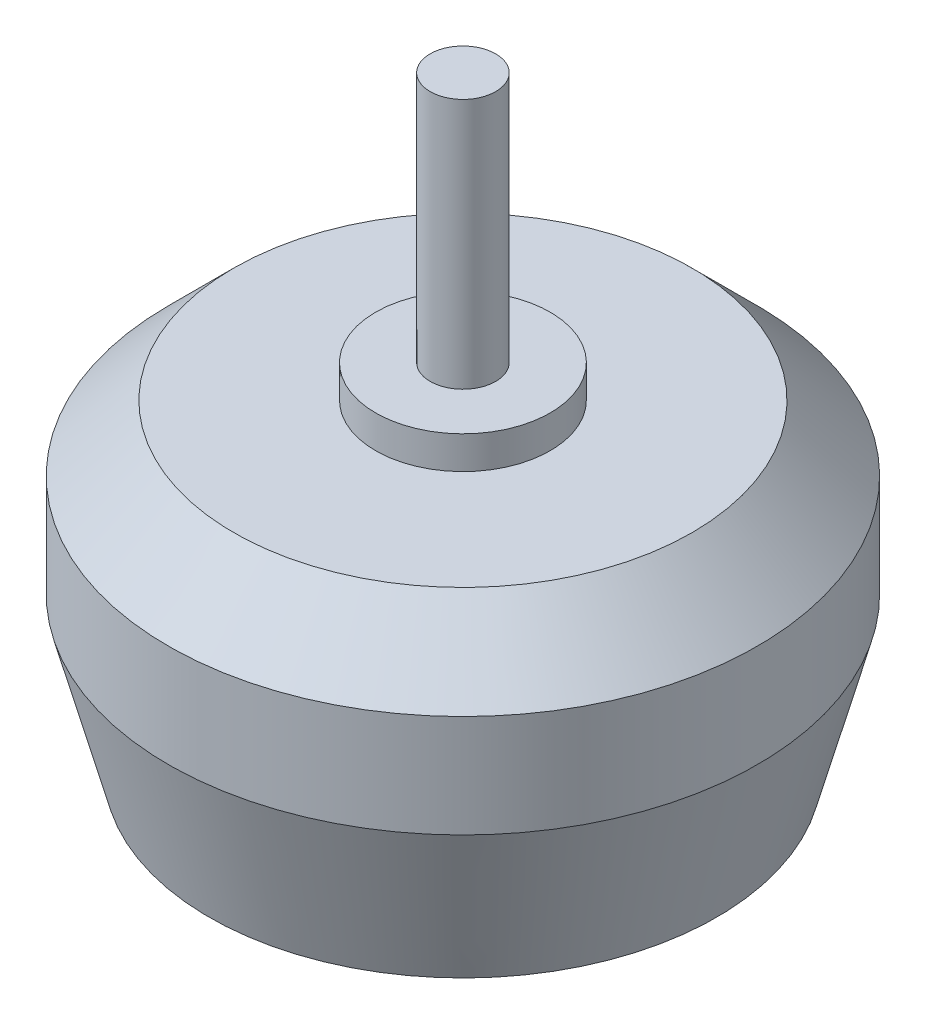
from build123d import *

# Parameters (mm, degrees)
SKETCH3_R          = 1.375
CUT_EXTRUDE1_DEPTH = 2


with BuildPart() as part:
    # Sketch2 → Revolve1 (revolve)
    with BuildSketch(Plane.XY, mode=Mode.PRIVATE) as revolve1_sk:
        Polygon((1.5, 0), (11.624355653, 0), (13.5, 7), (13.5, 11.7), (10.5, 14.7), (4, 14.7), (4, 16.2), (1.5, 16.2), (1.5, 27.7), (0, 27.7), (0, -2.1), (1.5, -2.1), align=None)
    revolve(revolve1_sk.sketch.rotate(Axis((0, -2.1, 0), (0, -1, 0)), 180), axis=Axis((0, -2.1, 0), (0, -1, 0)))

    # Sketch3 → Cut-Extrude1 (cut)
    with BuildSketch(Plane.XZ):
        with Locations((0, 9.5)):
            Circle(SKETCH3_R)
        with Locations((0, -9.5)):
            Circle(SKETCH3_R)
        with Locations((-8, 0)):
            Circle(SKETCH3_R)
        with Locations((8, 0)):
            Circle(SKETCH3_R)
    extrude(amount=-CUT_EXTRUDE1_DEPTH, mode=Mode.SUBTRACT)


solid = part.part
